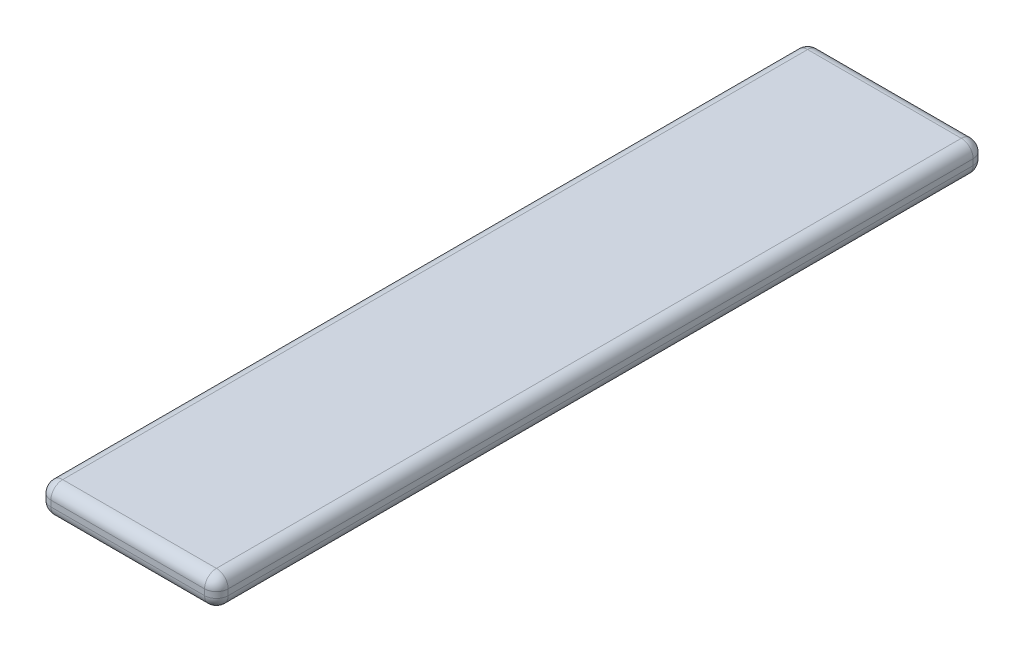
from build123d import *

# Parameters (mm, degrees)
SKETCH1_W           = 38.1
SKETCH1_H           = 165.1
BOSS_EXTRUDE1_DEPTH = 6.35
FILLET1_R           = 2.54


with BuildPart() as part:
    # Sketch1 → Boss-Extrude1 (new body)
    with BuildSketch(Plane(origin=(0, 0, 0), x_dir=(1, 0, 0), z_dir=(0, 1, 0))):
        with Locations((19.05, 82.55)):
            Rectangle(SKETCH1_W, SKETCH1_H)
    extrude(amount=BOSS_EXTRUDE1_DEPTH)

    # Fillet1
    fillet1_edges = [part.edges().sort_by_distance(p)[0] for p in [
        (19.05, 6.35, 0),
        (0, 6.35, -82.55),
        (19.05, 6.35, -165.1),
        (0, 0, -82.55),
        (19.05, 0, 0),
        (38.1, 0, -82.55),
        (19.05, 0, -165.1),
        (0, 3.175, -165.1),
        (0, 3.175, 0),
        (38.1, 3.175, 0),
        (38.1, 3.175, -165.1),
        (38.1, 6.35, -82.55),
    ]]
    fillet(fillet1_edges, radius=FILLET1_R)


solid = part.part
